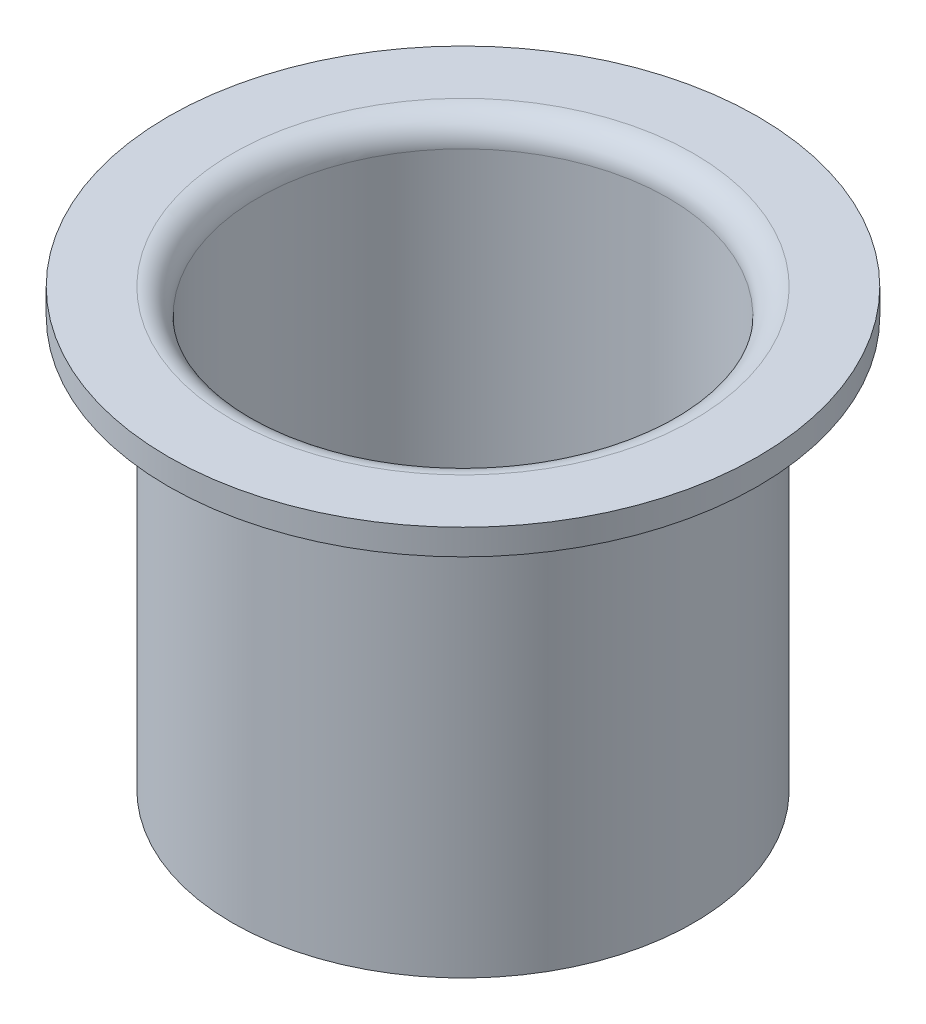
from build123d import *


with BuildPart() as part:
    # 草图1 → 旋转-薄壁1 (revolve)
    with BuildSketch(Plane(origin=(0, 0, 0), x_dir=(0, 0, -1), z_dir=(1, 0, 0))):
        with BuildLine():
            Line((8, 0.906546657), (8, 16.906546657))
            ThreePointArc((8, 16.906546657), (8.292893219, 17.613653438), (9, 17.906546657))
            Line((9, 17.906546657), (11.5, 17.906546657))
            Line((11.5, 17.906546657), (11.5, 16.906546657))
            Line((11.5, 16.906546657), (9, 16.906546657))
            Line((9, 16.906546657), (9, 0.906546657))
            Line((9, 0.906546657), (8, 0.906546657))
        make_face()
    revolve(axis=Axis((0, 0, 0), (0, 1, 0)))


solid = part.part
